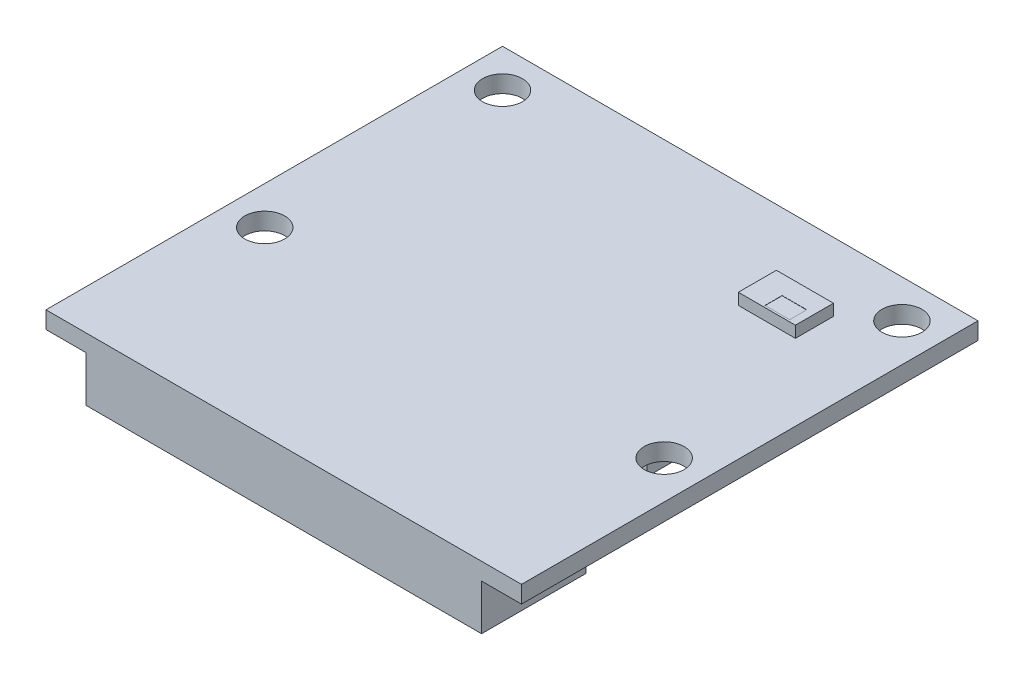
from build123d import *

# Parameters (mm, degrees)
SKIZZE1_W                                 = 25
SKIZZE1_H                                 = 24
PCB_DEPTH                                 = 0.9
SKIZZE2_R                                 = 1.05
MOUNTING_HOLES_DEPTH                      = 20.165333287
SKIZZE3_W                                 = 20.8
SKIZZE3_H                                 = 5.5
CONNECTOR_CLOSED_DEPTH                    = 2.4
SKIZZE4_W                                 = 17.7
SKIZZE4_H                                 = 11.6
COMPONENTS_WORST_CASE_BOUNDARY_BOX_DEPTH  = 1.3
SKIZZE7_W                                 = 3
SKIZZE7_H                                 = 2
COMPONENTS_WORST_CASE_BOUNDARY_BOX2_DEPTH = 0.6
SKIZZE8_W                                 = 1.3
SKIZZE8_H                                 = 0.9
STATUS_LED_DEPTH                          = 0.01


with BuildPart() as part:
    # Skizze1 → PCB (new body)
    with BuildSketch(Plane(origin=(0, 0, 0), x_dir=(1, 0, 0), z_dir=(0, 1, 0))):
        with Locations((0, 2.5)):
            Rectangle(SKIZZE1_W, SKIZZE1_H)
    extrude(amount=-PCB_DEPTH)

    # Skizze2 → Mounting_Holes (cut, through all)
    with BuildSketch(Plane(origin=(0, 0, 0), x_dir=(1, 0, 0), z_dir=(0, 1, 0))):
        with Locations(Location((10.5, 12.5, 0), (0, 0, 270))):
            Circle(SKIZZE2_R)
        with Locations(Location((10.5, 0, 0), (0, 0, 270))):
            Circle(SKIZZE2_R)
        with Locations(Location((-10.5, 0, 0), (0, 0, 90))):
            Circle(SKIZZE2_R)
        with Locations(Location((-10.5, 12.5, 0), (0, 0, 90))):
            Circle(SKIZZE2_R)
    extrude(amount=-MOUNTING_HOLES_DEPTH, mode=Mode.SUBTRACT)

    # Skizze3 → Connector_closed (add)
    with BuildSketch(Plane.XZ.offset(0.9)):
        with Locations((0, 6.75)):
            Rectangle(SKIZZE3_W, SKIZZE3_H)
    extrude(amount=CONNECTOR_CLOSED_DEPTH)

    # Skizze4 → Components_worst-case_Boundary-Box (add)
    with BuildSketch(Plane.XZ.offset(0.9)):
        with Locations((-0.15, -6.7)):
            Rectangle(SKIZZE4_W, SKIZZE4_H)
    extrude(amount=COMPONENTS_WORST_CASE_BOUNDARY_BOX_DEPTH)

    # Skizze7 → Components_worst-case_Boundary-Box2 (add)
    with BuildSketch(Plane(origin=(0, 0, 0), x_dir=(1, 0, 0), z_dir=(0, 1, 0))):
        with Locations((7, 9.9)):
            Rectangle(SKIZZE7_W, SKIZZE7_H)
    extrude(amount=COMPONENTS_WORST_CASE_BOUNDARY_BOX2_DEPTH)

    # Skizze8 → Status_LED (cut)
    with BuildSketch(Plane(origin=(0, 0.6, 0), x_dir=(1, 0, 0), z_dir=(0, 1, 0))):
        with Locations((7.45, 9.45)):
            Rectangle(SKIZZE8_W, SKIZZE8_H)
    extrude(amount=-STATUS_LED_DEPTH, mode=Mode.SUBTRACT)


solid = part.part
